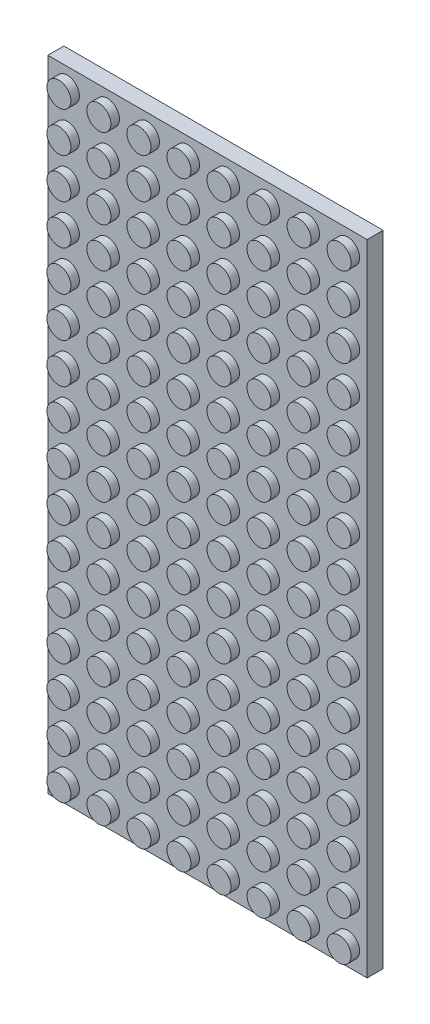
from build123d import *

# Parameters (mm, degrees)
SKETCH_1_W          = 63.8
SKETCH_1_H          = 127.8
EXTRUDE_1_DEPTH     = 3.2
SKETCH_2_R          = 2.4
EXTRUDE_2_DEPTH     = 1.7
SKETCH_3_R          = 2.5
CUT_EXTRUDE_1_DEPTH = 1.8


with BuildPart() as part:
    # Эскиз1 → Бобышка-Вытянуть1 (new body)
    with BuildSketch(Plane.XY):
        Rectangle(SKETCH_1_W, SKETCH_1_H)
    extrude(amount=EXTRUDE_1_DEPTH)

    # Эскиз2 → Бобышка-Вытянуть2 (add)
    with BuildSketch(Plane.XY.offset(3.2)):
        with Locations(Location((-28, 60, 0), (0, 0, 180))):
            Circle(SKETCH_2_R)
        with Locations(Location((-20, 60, 0), (0, 0, 180))):
            Circle(SKETCH_2_R)
        with Locations(Location((-12, 60, 0), (0, 0, 180))):
            Circle(SKETCH_2_R)
        with Locations(Location((-4, 60, 0), (0, 0, 180))):
            Circle(SKETCH_2_R)
        with Locations(Location((4, 60, 0), (0, 0, 180))):
            Circle(SKETCH_2_R)
        with Locations(Location((12, 60, 0), (0, 0, 180))):
            Circle(SKETCH_2_R)
        with Locations(Location((20, 60, 0), (0, 0, 180))):
            Circle(SKETCH_2_R)
        with Locations(Location((28, 60, 0), (0, 0, 180))):
            Circle(SKETCH_2_R)
        with Locations(Location((-20, 52, 0), (0, 0, 180))):
            Circle(SKETCH_2_R)
        with Locations(Location((-12, 52, 0), (0, 0, 180))):
            Circle(SKETCH_2_R)
        with Locations(Location((-4, 52, 0), (0, 0, 180))):
            Circle(SKETCH_2_R)
        with Locations(Location((4, 52, 0), (0, 0, 180))):
            Circle(SKETCH_2_R)
        with Locations(Location((12, 52, 0), (0, 0, 180))):
            Circle(SKETCH_2_R)
        with Locations(Location((20, 52, 0), (0, 0, 180))):
            Circle(SKETCH_2_R)
        with Locations(Location((28, 52, 0), (0, 0, 180))):
            Circle(SKETCH_2_R)
        with Locations(Location((-20, 44, 0), (0, 0, 180))):
            Circle(SKETCH_2_R)
        with Locations(Location((-12, 44, 0), (0, 0, 180))):
            Circle(SKETCH_2_R)
        with Locations(Location((-4, 44, 0), (0, 0, 180))):
            Circle(SKETCH_2_R)
        with Locations(Location((4, 44, 0), (0, 0, 180))):
            Circle(SKETCH_2_R)
        with Locations(Location((12, 44, 0), (0, 0, 180))):
            Circle(SKETCH_2_R)
        with Locations(Location((20, 44, 0), (0, 0, 180))):
            Circle(SKETCH_2_R)
        with Locations(Location((28, 44, 0), (0, 0, 180))):
            Circle(SKETCH_2_R)
        with Locations(Location((-20, 36, 0), (0, 0, 180))):
            Circle(SKETCH_2_R)
        with Locations(Location((-12, 36, 0), (0, 0, 180))):
            Circle(SKETCH_2_R)
        with Locations(Location((-4, 36, 0), (0, 0, 180))):
            Circle(SKETCH_2_R)
        with Locations(Location((4, 36, 0), (0, 0, 180))):
            Circle(SKETCH_2_R)
        with Locations(Location((12, 36, 0), (0, 0, 180))):
            Circle(SKETCH_2_R)
        with Locations(Location((20, 36, 0), (0, 0, 180))):
            Circle(SKETCH_2_R)
        with Locations(Location((28, 36, 0), (0, 0, 180))):
            Circle(SKETCH_2_R)
        with Locations(Location((-20, 28, 0), (0, 0, 180))):
            Circle(SKETCH_2_R)
        with Locations(Location((-12, 28, 0), (0, 0, 180))):
            Circle(SKETCH_2_R)
        with Locations(Location((-4, 28, 0), (0, 0, 180))):
            Circle(SKETCH_2_R)
        with Locations(Location((4, 28, 0), (0, 0, 180))):
            Circle(SKETCH_2_R)
        with Locations(Location((12, 28, 0), (0, 0, 180))):
            Circle(SKETCH_2_R)
        with Locations(Location((20, 28, 0), (0, 0, 180))):
            Circle(SKETCH_2_R)
        with Locations(Location((28, 28, 0), (0, 0, 180))):
            Circle(SKETCH_2_R)
        with Locations(Location((-20, 20, 0), (0, 0, 180))):
            Circle(SKETCH_2_R)
        with Locations(Location((-12, 20, 0), (0, 0, 180))):
            Circle(SKETCH_2_R)
        with Locations(Location((-4, 20, 0), (0, 0, 180))):
            Circle(SKETCH_2_R)
        with Locations(Location((4, 20, 0), (0, 0, 180))):
            Circle(SKETCH_2_R)
        with Locations(Location((12, 20, 0), (0, 0, 180))):
            Circle(SKETCH_2_R)
        with Locations(Location((20, 20, 0), (0, 0, 180))):
            Circle(SKETCH_2_R)
        with Locations(Location((28, 20, 0), (0, 0, 180))):
            Circle(SKETCH_2_R)
        with Locations(Location((-20, 12, 0), (0, 0, 180))):
            Circle(SKETCH_2_R)
        with Locations(Location((-12, 12, 0), (0, 0, 180))):
            Circle(SKETCH_2_R)
        with Locations(Location((-4, 12, 0), (0, 0, 180))):
            Circle(SKETCH_2_R)
        with Locations(Location((4, 12, 0), (0, 0, 180))):
            Circle(SKETCH_2_R)
        with Locations(Location((12, 12, 0), (0, 0, 180))):
            Circle(SKETCH_2_R)
        with Locations(Location((20, 12, 0), (0, 0, 180))):
            Circle(SKETCH_2_R)
        with Locations(Location((28, 12, 0), (0, 0, 180))):
            Circle(SKETCH_2_R)
        with Locations(Location((-20, 4, 0), (0, 0, 180))):
            Circle(SKETCH_2_R)
        with Locations(Location((-12, 4, 0), (0, 0, 180))):
            Circle(SKETCH_2_R)
        with Locations(Location((-4, 4, 0), (0, 0, 180))):
            Circle(SKETCH_2_R)
        with Locations(Location((4, 4, 0), (0, 0, 180))):
            Circle(SKETCH_2_R)
        with Locations(Location((12, 4, 0), (0, 0, 180))):
            Circle(SKETCH_2_R)
        with Locations(Location((20, 4, 0), (0, 0, 180))):
            Circle(SKETCH_2_R)
        with Locations(Location((28, 4, 0), (0, 0, 180))):
            Circle(SKETCH_2_R)
        with Locations(Location((-20, -4, 0), (0, 0, 180))):
            Circle(SKETCH_2_R)
        with Locations(Location((-12, -4, 0), (0, 0, 180))):
            Circle(SKETCH_2_R)
        with Locations(Location((-4, -4, 0), (0, 0, 180))):
            Circle(SKETCH_2_R)
        with Locations(Location((4, -4, 0), (0, 0, 180))):
            Circle(SKETCH_2_R)
        with Locations(Location((12, -4, 0), (0, 0, 180))):
            Circle(SKETCH_2_R)
        with Locations(Location((20, -4, 0), (0, 0, 180))):
            Circle(SKETCH_2_R)
        with Locations(Location((28, -4, 0), (0, 0, 180))):
            Circle(SKETCH_2_R)
        with Locations(Location((-20, -12, 0), (0, 0, 180))):
            Circle(SKETCH_2_R)
        with Locations(Location((-12, -12, 0), (0, 0, 180))):
            Circle(SKETCH_2_R)
        with Locations(Location((-4, -12, 0), (0, 0, 180))):
            Circle(SKETCH_2_R)
        with Locations(Location((4, -12, 0), (0, 0, 180))):
            Circle(SKETCH_2_R)
        with Locations(Location((12, -12, 0), (0, 0, 180))):
            Circle(SKETCH_2_R)
        with Locations(Location((20, -12, 0), (0, 0, 180))):
            Circle(SKETCH_2_R)
        with Locations(Location((28, -12, 0), (0, 0, 180))):
            Circle(SKETCH_2_R)
        with Locations(Location((-20, -20, 0), (0, 0, 180))):
            Circle(SKETCH_2_R)
        with Locations(Location((-12, -20, 0), (0, 0, 180))):
            Circle(SKETCH_2_R)
        with Locations(Location((-4, -20, 0), (0, 0, 180))):
            Circle(SKETCH_2_R)
        with Locations(Location((4, -20, 0), (0, 0, 180))):
            Circle(SKETCH_2_R)
        with Locations(Location((12, -20, 0), (0, 0, 180))):
            Circle(SKETCH_2_R)
        with Locations(Location((20, -20, 0), (0, 0, 180))):
            Circle(SKETCH_2_R)
        with Locations(Location((28, -20, 0), (0, 0, 180))):
            Circle(SKETCH_2_R)
        with Locations(Location((-20, -28, 0), (0, 0, 180))):
            Circle(SKETCH_2_R)
        with Locations(Location((-12, -28, 0), (0, 0, 180))):
            Circle(SKETCH_2_R)
        with Locations(Location((-4, -28, 0), (0, 0, 180))):
            Circle(SKETCH_2_R)
        with Locations(Location((4, -28, 0), (0, 0, 180))):
            Circle(SKETCH_2_R)
        with Locations(Location((12, -28, 0), (0, 0, 180))):
            Circle(SKETCH_2_R)
        with Locations(Location((20, -28, 0), (0, 0, 180))):
            Circle(SKETCH_2_R)
        with Locations(Location((28, -28, 0), (0, 0, 180))):
            Circle(SKETCH_2_R)
        with Locations(Location((-20, -36, 0), (0, 0, 180))):
            Circle(SKETCH_2_R)
        with Locations(Location((-12, -36, 0), (0, 0, 180))):
            Circle(SKETCH_2_R)
        with Locations(Location((-4, -36, 0), (0, 0, 180))):
            Circle(SKETCH_2_R)
        with Locations(Location((4, -36, 0), (0, 0, 180))):
            Circle(SKETCH_2_R)
        with Locations(Location((12, -36, 0), (0, 0, 180))):
            Circle(SKETCH_2_R)
        with Locations(Location((20, -36, 0), (0, 0, 180))):
            Circle(SKETCH_2_R)
        with Locations(Location((28, -36, 0), (0, 0, 180))):
            Circle(SKETCH_2_R)
        with Locations(Location((-20, -44, 0), (0, 0, 180))):
            Circle(SKETCH_2_R)
        with Locations(Location((-12, -44, 0), (0, 0, 180))):
            Circle(SKETCH_2_R)
        with Locations(Location((-4, -44, 0), (0, 0, 180))):
            Circle(SKETCH_2_R)
        with Locations(Location((4, -44, 0), (0, 0, 180))):
            Circle(SKETCH_2_R)
        with Locations(Location((12, -44, 0), (0, 0, 180))):
            Circle(SKETCH_2_R)
        with Locations(Location((20, -44, 0), (0, 0, 180))):
            Circle(SKETCH_2_R)
        with Locations(Location((28, -44, 0), (0, 0, 180))):
            Circle(SKETCH_2_R)
        with Locations(Location((-20, -52, 0), (0, 0, 180))):
            Circle(SKETCH_2_R)
        with Locations(Location((-12, -52, 0), (0, 0, 180))):
            Circle(SKETCH_2_R)
        with Locations(Location((-4, -52, 0), (0, 0, 180))):
            Circle(SKETCH_2_R)
        with Locations(Location((4, -52, 0), (0, 0, 180))):
            Circle(SKETCH_2_R)
        with Locations(Location((12, -52, 0), (0, 0, 180))):
            Circle(SKETCH_2_R)
        with Locations(Location((20, -52, 0), (0, 0, 180))):
            Circle(SKETCH_2_R)
        with Locations(Location((28, -52, 0), (0, 0, 180))):
            Circle(SKETCH_2_R)
        with Locations(Location((-20, -60, 0), (0, 0, 180))):
            Circle(SKETCH_2_R)
        with Locations(Location((-12, -60, 0), (0, 0, 180))):
            Circle(SKETCH_2_R)
        with Locations(Location((-4, -60, 0), (0, 0, 180))):
            Circle(SKETCH_2_R)
        with Locations(Location((4, -60, 0), (0, 0, 180))):
            Circle(SKETCH_2_R)
        with Locations(Location((12, -60, 0), (0, 0, 180))):
            Circle(SKETCH_2_R)
        with Locations(Location((20, -60, 0), (0, 0, 180))):
            Circle(SKETCH_2_R)
        with Locations(Location((28, -60, 0), (0, 0, 180))):
            Circle(SKETCH_2_R)
        with Locations(Location((-28, 52, 0), (0, 0, 180))):
            Circle(SKETCH_2_R)
        with Locations(Location((-28, 44, 0), (0, 0, 180))):
            Circle(SKETCH_2_R)
        with Locations(Location((-28, 36, 0), (0, 0, 180))):
            Circle(SKETCH_2_R)
        with Locations(Location((-28, 28, 0), (0, 0, 180))):
            Circle(SKETCH_2_R)
        with Locations(Location((-28, 20, 0), (0, 0, 180))):
            Circle(SKETCH_2_R)
        with Locations(Location((-28, 12, 0), (0, 0, 180))):
            Circle(SKETCH_2_R)
        with Locations(Location((-28, 4, 0), (0, 0, 180))):
            Circle(SKETCH_2_R)
        with Locations(Location((-28, -4, 0), (0, 0, 180))):
            Circle(SKETCH_2_R)
        with Locations(Location((-28, -12, 0), (0, 0, 180))):
            Circle(SKETCH_2_R)
        with Locations(Location((-28, -20, 0), (0, 0, 180))):
            Circle(SKETCH_2_R)
        with Locations(Location((-28, -28, 0), (0, 0, 180))):
            Circle(SKETCH_2_R)
        with Locations(Location((-28, -36, 0), (0, 0, 180))):
            Circle(SKETCH_2_R)
        with Locations(Location((-28, -44, 0), (0, 0, 180))):
            Circle(SKETCH_2_R)
        with Locations(Location((-28, -52, 0), (0, 0, 180))):
            Circle(SKETCH_2_R)
        with Locations(Location((-28, -60, 0), (0, 0, 180))):
            Circle(SKETCH_2_R)
    extrude(amount=EXTRUDE_2_DEPTH)

    # Эскиз3 → Вырез-Вытянуть1 (cut)
    with BuildSketch(Plane(origin=(0, 0, 0), x_dir=(-1, 0, 0), z_dir=(0, 0, -1))):
        with Locations((-28, 60)):
            Circle(SKETCH_3_R)
        with Locations((-20, 60)):
            Circle(SKETCH_3_R)
        with Locations((-12, 60)):
            Circle(SKETCH_3_R)
        with Locations((-4, 60)):
            Circle(SKETCH_3_R)
        with Locations((4, 60)):
            Circle(SKETCH_3_R)
        with Locations((12, 60)):
            Circle(SKETCH_3_R)
        with Locations((20, 60)):
            Circle(SKETCH_3_R)
        with Locations((28, 60)):
            Circle(SKETCH_3_R)
        with Locations((-20, 52)):
            Circle(SKETCH_3_R)
        with Locations((-12, 52)):
            Circle(SKETCH_3_R)
        with Locations((-4, 52)):
            Circle(SKETCH_3_R)
        with Locations((4, 52)):
            Circle(SKETCH_3_R)
        with Locations((12, 52)):
            Circle(SKETCH_3_R)
        with Locations((20, 52)):
            Circle(SKETCH_3_R)
        with Locations((28, 52)):
            Circle(SKETCH_3_R)
        with Locations((-20, 44)):
            Circle(SKETCH_3_R)
        with Locations((-12, 44)):
            Circle(SKETCH_3_R)
        with Locations((-4, 44)):
            Circle(SKETCH_3_R)
        with Locations((4, 44)):
            Circle(SKETCH_3_R)
        with Locations((12, 44)):
            Circle(SKETCH_3_R)
        with Locations((20, 44)):
            Circle(SKETCH_3_R)
        with Locations((28, 44)):
            Circle(SKETCH_3_R)
        with Locations((-20, 36)):
            Circle(SKETCH_3_R)
        with Locations((-12, 36)):
            Circle(SKETCH_3_R)
        with Locations((-4, 36)):
            Circle(SKETCH_3_R)
        with Locations((4, 36)):
            Circle(SKETCH_3_R)
        with Locations((12, 36)):
            Circle(SKETCH_3_R)
        with Locations((20, 36)):
            Circle(SKETCH_3_R)
        with Locations((28, 36)):
            Circle(SKETCH_3_R)
        with Locations((-20, 28)):
            Circle(SKETCH_3_R)
        with Locations((-12, 28)):
            Circle(SKETCH_3_R)
        with Locations((-4, 28)):
            Circle(SKETCH_3_R)
        with Locations((4, 28)):
            Circle(SKETCH_3_R)
        with Locations((12, 28)):
            Circle(SKETCH_3_R)
        with Locations((20, 28)):
            Circle(SKETCH_3_R)
        with Locations((28, 28)):
            Circle(SKETCH_3_R)
        with Locations((-20, 20)):
            Circle(SKETCH_3_R)
        with Locations((-12, 20)):
            Circle(SKETCH_3_R)
        with Locations((-4, 20)):
            Circle(SKETCH_3_R)
        with Locations((4, 20)):
            Circle(SKETCH_3_R)
        with Locations((12, 20)):
            Circle(SKETCH_3_R)
        with Locations((20, 20)):
            Circle(SKETCH_3_R)
        with Locations((28, 20)):
            Circle(SKETCH_3_R)
        with Locations((-20, 12)):
            Circle(SKETCH_3_R)
        with Locations((-12, 12)):
            Circle(SKETCH_3_R)
        with Locations((-4, 12)):
            Circle(SKETCH_3_R)
        with Locations((4, 12)):
            Circle(SKETCH_3_R)
        with Locations((12, 12)):
            Circle(SKETCH_3_R)
        with Locations((20, 12)):
            Circle(SKETCH_3_R)
        with Locations((28, 12)):
            Circle(SKETCH_3_R)
        with Locations((-20, 4)):
            Circle(SKETCH_3_R)
        with Locations((-12, 4)):
            Circle(SKETCH_3_R)
        with Locations((-4, 4)):
            Circle(SKETCH_3_R)
        with Locations((4, 4)):
            Circle(SKETCH_3_R)
        with Locations((12, 4)):
            Circle(SKETCH_3_R)
        with Locations((20, 4)):
            Circle(SKETCH_3_R)
        with Locations((28, 4)):
            Circle(SKETCH_3_R)
        with Locations((-20, -4)):
            Circle(SKETCH_3_R)
        with Locations((-12, -4)):
            Circle(SKETCH_3_R)
        with Locations((-4, -4)):
            Circle(SKETCH_3_R)
        with Locations((4, -4)):
            Circle(SKETCH_3_R)
        with Locations((12, -4)):
            Circle(SKETCH_3_R)
        with Locations((20, -4)):
            Circle(SKETCH_3_R)
        with Locations((28, -4)):
            Circle(SKETCH_3_R)
        with Locations((-20, -12)):
            Circle(SKETCH_3_R)
        with Locations((-12, -12)):
            Circle(SKETCH_3_R)
        with Locations((-4, -12)):
            Circle(SKETCH_3_R)
        with Locations((4, -12)):
            Circle(SKETCH_3_R)
        with Locations((12, -12)):
            Circle(SKETCH_3_R)
        with Locations((20, -12)):
            Circle(SKETCH_3_R)
        with Locations((28, -12)):
            Circle(SKETCH_3_R)
        with Locations((-20, -20)):
            Circle(SKETCH_3_R)
        with Locations((-12, -20)):
            Circle(SKETCH_3_R)
        with Locations((-4, -20)):
            Circle(SKETCH_3_R)
        with Locations((4, -20)):
            Circle(SKETCH_3_R)
        with Locations((12, -20)):
            Circle(SKETCH_3_R)
        with Locations((20, -20)):
            Circle(SKETCH_3_R)
        with Locations((28, -20)):
            Circle(SKETCH_3_R)
        with Locations((-20, -28)):
            Circle(SKETCH_3_R)
        with Locations((-12, -28)):
            Circle(SKETCH_3_R)
        with Locations((-4, -28)):
            Circle(SKETCH_3_R)
        with Locations((4, -28)):
            Circle(SKETCH_3_R)
        with Locations((12, -28)):
            Circle(SKETCH_3_R)
        with Locations((20, -28)):
            Circle(SKETCH_3_R)
        with Locations((28, -28)):
            Circle(SKETCH_3_R)
        with Locations((-20, -36)):
            Circle(SKETCH_3_R)
        with Locations((-12, -36)):
            Circle(SKETCH_3_R)
        with Locations((-4, -36)):
            Circle(SKETCH_3_R)
        with Locations((4, -36)):
            Circle(SKETCH_3_R)
        with Locations((12, -36)):
            Circle(SKETCH_3_R)
        with Locations((20, -36)):
            Circle(SKETCH_3_R)
        with Locations((28, -36)):
            Circle(SKETCH_3_R)
        with Locations((-20, -44)):
            Circle(SKETCH_3_R)
        with Locations((-12, -44)):
            Circle(SKETCH_3_R)
        with Locations((-4, -44)):
            Circle(SKETCH_3_R)
        with Locations((4, -44)):
            Circle(SKETCH_3_R)
        with Locations((12, -44)):
            Circle(SKETCH_3_R)
        with Locations((20, -44)):
            Circle(SKETCH_3_R)
        with Locations((28, -44)):
            Circle(SKETCH_3_R)
        with Locations((-20, -52)):
            Circle(SKETCH_3_R)
        with Locations((-12, -52)):
            Circle(SKETCH_3_R)
        with Locations((-4, -52)):
            Circle(SKETCH_3_R)
        with Locations((4, -52)):
            Circle(SKETCH_3_R)
        with Locations((12, -52)):
            Circle(SKETCH_3_R)
        with Locations((20, -52)):
            Circle(SKETCH_3_R)
        with Locations((28, -52)):
            Circle(SKETCH_3_R)
        with Locations((-20, -60)):
            Circle(SKETCH_3_R)
        with Locations((-12, -60)):
            Circle(SKETCH_3_R)
        with Locations((-4, -60)):
            Circle(SKETCH_3_R)
        with Locations((4, -60)):
            Circle(SKETCH_3_R)
        with Locations((12, -60)):
            Circle(SKETCH_3_R)
        with Locations((20, -60)):
            Circle(SKETCH_3_R)
        with Locations((28, -60)):
            Circle(SKETCH_3_R)
        with Locations((-28, 52)):
            Circle(SKETCH_3_R)
        with Locations((-28, 44)):
            Circle(SKETCH_3_R)
        with Locations((-28, 36)):
            Circle(SKETCH_3_R)
        with Locations((-28, 28)):
            Circle(SKETCH_3_R)
        with Locations((-28, 20)):
            Circle(SKETCH_3_R)
        with Locations((-28, 12)):
            Circle(SKETCH_3_R)
        with Locations((-28, 4)):
            Circle(SKETCH_3_R)
        with Locations((-28, -4)):
            Circle(SKETCH_3_R)
        with Locations((-28, -12)):
            Circle(SKETCH_3_R)
        with Locations((-28, -20)):
            Circle(SKETCH_3_R)
        with Locations((-28, -28)):
            Circle(SKETCH_3_R)
        with Locations((-28, -36)):
            Circle(SKETCH_3_R)
        with Locations((-28, -44)):
            Circle(SKETCH_3_R)
        with Locations((-28, -52)):
            Circle(SKETCH_3_R)
        with Locations((-28, -60)):
            Circle(SKETCH_3_R)
    extrude(amount=-CUT_EXTRUDE_1_DEPTH, mode=Mode.SUBTRACT)


solid = part.part
